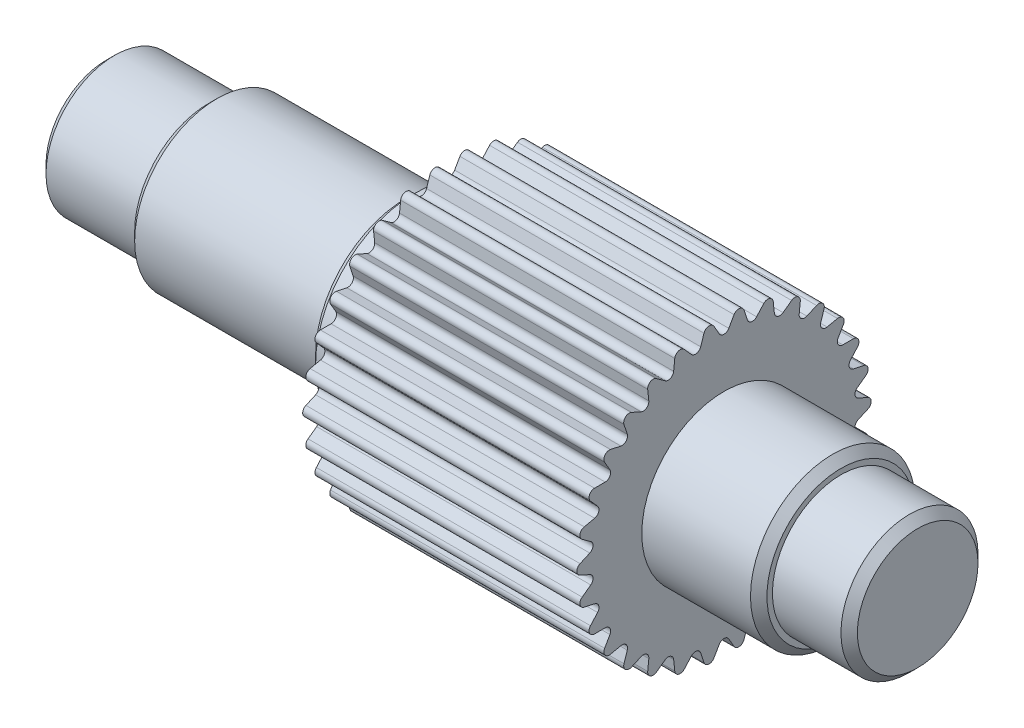
from build123d import *

# Parameters (mm, degrees)
CUT_EXTRUDE_START        = -10
CUT_EXTRUDE_1_DEPTH      = 168.009171707
CUT_EXTRUDE_3_REACH      = 121.806
PATTERN_CIRCULAR_4_COUNT = 30
FILLET_4_R               = 1
CHAMFER_1_SIZE           = 1.5


with BuildPart() as part:
    # Эскиз1 → Повернуть1 (revolve)
    with BuildSketch(Plane.XY, mode=Mode.PRIVATE) as revolve_1_sk:
        Polygon((54.670592349, -18), (62.670592349, -18), (62.670592349, -28.8), (112.670592349, -28.8), (112.670592349, -15), (134, -15), (134, -12.5), (148, -12.5), (148, 0), (0, 0), (0, -12.5), (18.670592349, -12.5), (18.670592349, -15), (54.670592349, -15), align=None)
    revolve(revolve_1_sk.sketch.rotate(Axis((0, 0, 0), (1, 0, 0)), 270), axis=Axis((0, 0, 0), (1, 0, 0)))

    # Эскиз2 → Вырез-Повернуть1 (revolve, cut)
    with BuildSketch(Plane.XY, mode=Mode.PRIVATE) as cut_revolve_1_sk:
        Polygon((0, 0), (0, 4.25), (3.9, 2), (8.9, 2), (10.054700538, 0), align=None)
    revolve(cut_revolve_1_sk.sketch.rotate(Axis((0, 0, 0), (1, 0, 0)), 90), axis=Axis((0, 0, 0), (1, 0, 0)), mode=Mode.SUBTRACT)

    # Эскиз3 → Вырез-Вытянуть1 (cut, through all)
    with BuildSketch(Plane(origin=(0, 0, -15), x_dir=(-1, 0, 0), z_dir=(0, 0, -1)).offset(CUT_EXTRUDE_START)):
        with BuildLine():
            Line((-29.670592349, -4), (-43.670592349, -4))
            ThreePointArc((-43.670592349, -4), (-47.670592349, 0), (-43.670592349, 4))
            Line((-43.670592349, 4), (-29.670592349, 4))
            ThreePointArc((-29.670592349, 4), (-25.670592349, 0), (-29.670592349, -4))
        make_face()
    extrude(amount=CUT_EXTRUDE_1_DEPTH, mode=Mode.SUBTRACT)

    # Эскиз4 → Вырез-Вытянуть3 (cut, up to next)
    with BuildSketch(Plane(origin=(112.670592349, 0, 0), x_dir=(0, 0, -1), z_dir=(1, 0, 0)), mode=Mode.PRIVATE) as cut_extrude_3_sk1:
        Polygon((5, 31.686751346), (-5, 31.686751346), (0, 23.026497308), align=None)
    cut_extrude_3_tool1 = extrude(cut_extrude_3_sk1.sketch, amount=-CUT_EXTRUDE_3_REACH, mode=Mode.PRIVATE) & part.part
    cut_extrude_3 = cut_extrude_3_tool1.solids().sort_by_distance((112.670592, 28.8, 0))[0]
    add(cut_extrude_3, mode=Mode.SUBTRACT)

    # Круговой массив4: Вырез-Вытянуть3 ×30 about axis
    pattern_circular_4_axis = Axis((0, 0, 0), (1, 0, 0))
    for i in range(1, PATTERN_CIRCULAR_4_COUNT):
        add(cut_extrude_3.rotate(pattern_circular_4_axis, i * 360 / PATTERN_CIRCULAR_4_COUNT), mode=Mode.SUBTRACT)

    # Скругление4
    fillet_4_edges = [part.edges().sort_by_distance(p)[0] for p in [
        (87.670592349, 28.15133101, -2.958824118),
        (87.670592349, 22.523313095, -4.787477989),
        (87.670592349, 26.92098276, -8.747157541),
        (87.670592349, 21.035752021, -9.365720217),
        (87.670592349, 24.514058382, -14.153198206),
        (87.670592349, 18.628827643, -13.53463553),
        (87.670592349, 21.035752021, -18.940676195),
        (87.670592349, 15.407734106, -17.112022323),
        (87.670592349, 16.638082356, -22.900355747),
        (87.670592349, 11.513248654, -19.941531629),
        (87.670592349, 11.513248654, -25.859179864),
        (87.670592349, 7.115578989, -21.899500312),
        (87.670592349, 5.885230739, -27.687833735),
        (87.670592349, 2.406924378, -22.900355747),
        (87.670592349, 0, -28.306396412),
        (87.670592349, -2.406924378, -22.900355747),
        (87.670592349, -5.885230739, -27.687833735),
        (87.670592349, -7.115578989, -21.899500312),
        (87.670592349, -11.513248654, -25.859179864),
        (87.670592349, -11.513248654, -19.941531629),
        (87.670592349, -16.638082356, -22.900355747),
        (87.670592349, -15.407734106, -17.112022323),
        (87.670592349, -21.035752021, -18.940676195),
        (87.670592349, -18.628827643, -13.53463553),
        (87.670592349, -24.514058382, -14.153198206),
        (87.670592349, -21.035752021, -9.365720217),
        (87.670592349, -26.92098276, -8.747157541),
        (87.670592349, -22.523313095, -4.787477989),
        (87.670592349, -28.15133101, -2.958824118),
        (87.670592349, -23.026497308, 0),
        (87.670592349, -28.15133101, 2.958824118),
        (87.670592349, -22.523313095, 4.787477989),
        (87.670592349, -26.92098276, 8.747157541),
        (87.670592349, -21.035752021, 9.365720217),
        (87.670592349, -24.514058382, 14.153198206),
        (87.670592349, -18.628827643, 13.53463553),
        (87.670592349, -21.035752021, 18.940676195),
        (87.670592349, -15.407734106, 17.112022323),
        (87.670592349, -16.638082356, 22.900355747),
        (87.670592349, -11.513248654, 19.941531629),
        (87.670592349, -11.513248654, 25.859179864),
        (87.670592349, -7.115578989, 21.899500312),
        (87.670592349, -5.885230739, 27.687833735),
        (87.670592349, -2.406924378, 22.900355747),
        (87.670592349, 0, 28.306396412),
        (87.670592349, 2.406924378, 22.900355747),
        (87.670592349, 5.885230739, 27.687833735),
        (87.670592349, 7.115578989, 21.899500312),
        (87.670592349, 11.513248654, 25.859179864),
        (87.670592349, 11.513248654, 19.941531629),
        (87.670592349, 16.638082356, 22.900355747),
        (87.670592349, 15.407734106, 17.112022323),
        (87.670592349, 21.035752021, 18.940676195),
        (87.670592349, 18.628827643, 13.53463553),
        (87.670592349, 24.514058382, 14.153198206),
        (87.670592349, 21.035752021, 9.365720217),
        (87.670592349, 28.15133101, 2.958824118),
        (87.670592349, 26.92098276, 8.747157541),
        (87.670592349, 22.523313095, 4.787477989),
        (87.670592349, 23.026497308, 0),
    ]]
    fillet(fillet_4_edges, radius=FILLET_4_R)

    # Фаска1
    chamfer_1_edges = [part.edges().sort_by_distance(p)[0] for p in [
        (54.670592349, 0, -18),
        (18.670592349, 0, -15),
        (0, 0, -12.5),
        (148, 0, -12.5),
        (134, 0, -15),
    ]]
    chamfer(chamfer_1_edges, length=CHAMFER_1_SIZE)


solid = part.part
